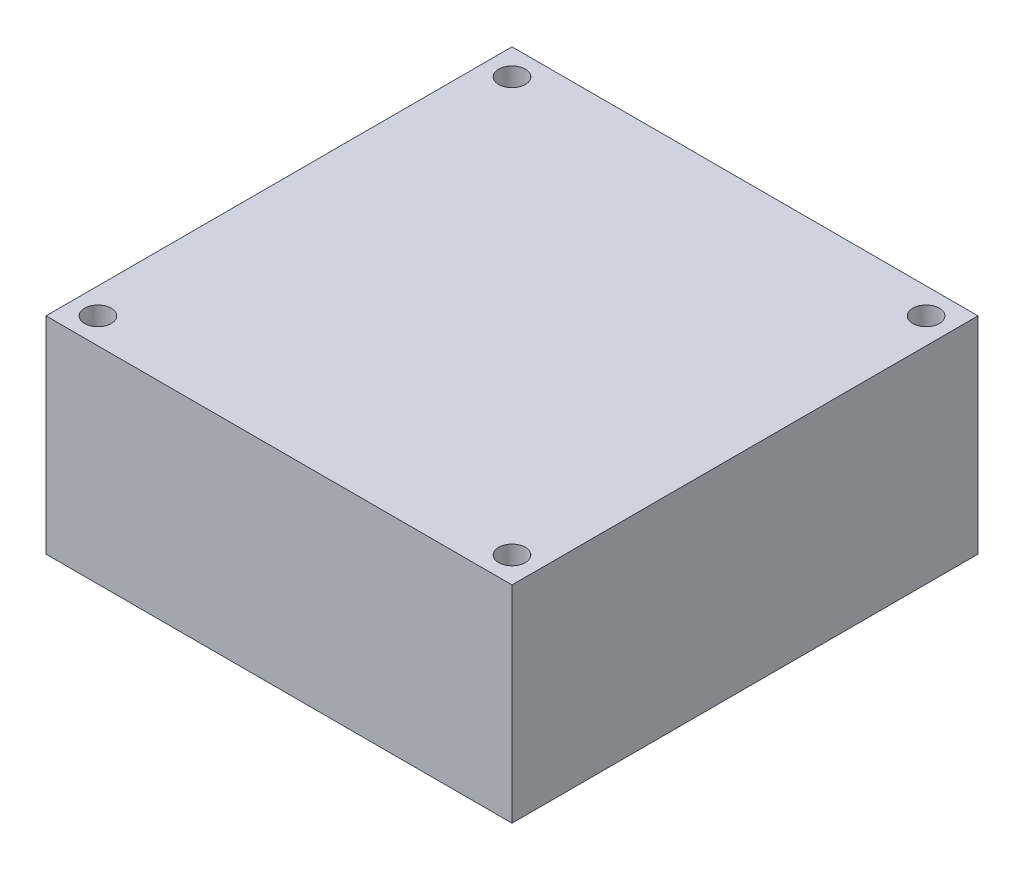
from build123d import *

# Parameters (mm, degrees)
SKETCH1_W           = 70
SKETCH1_H           = 70
BOSS_EXTRUDE1_DEPTH = 31
SKETCH2_R           = 2
CUT_EXTRUDE1_DEPTH  = 59.403767002


with BuildPart() as part:
    # Sketch1 → Boss-Extrude1 (new body)
    with BuildSketch(Plane(origin=(0, 0, 0), x_dir=(1, 0, 0), z_dir=(0, 1, 0))):
        Rectangle(SKETCH1_W, SKETCH1_H)
    extrude(amount=BOSS_EXTRUDE1_DEPTH)

    # Sketch2 → Cut-Extrude1 (cut, through all)
    with BuildSketch(Plane(origin=(0, 31, 0), x_dir=(1, 0, 0), z_dir=(0, 1, 0))):
        with Locations(Location((-31.1, 31.1, 0), (0, 0, 270))):
            Circle(SKETCH2_R)
        with Locations(Location((31.1, 31.1, 0), (0, 0, 270))):
            Circle(SKETCH2_R)
        with Locations(Location((31.1, -31.1, 0), (0, 0, 270))):
            Circle(SKETCH2_R)
        with Locations(Location((-31.1, -31.1, 0), (0, 0, 270))):
            Circle(SKETCH2_R)
    extrude(amount=-CUT_EXTRUDE1_DEPTH, mode=Mode.SUBTRACT)


solid = part.part
